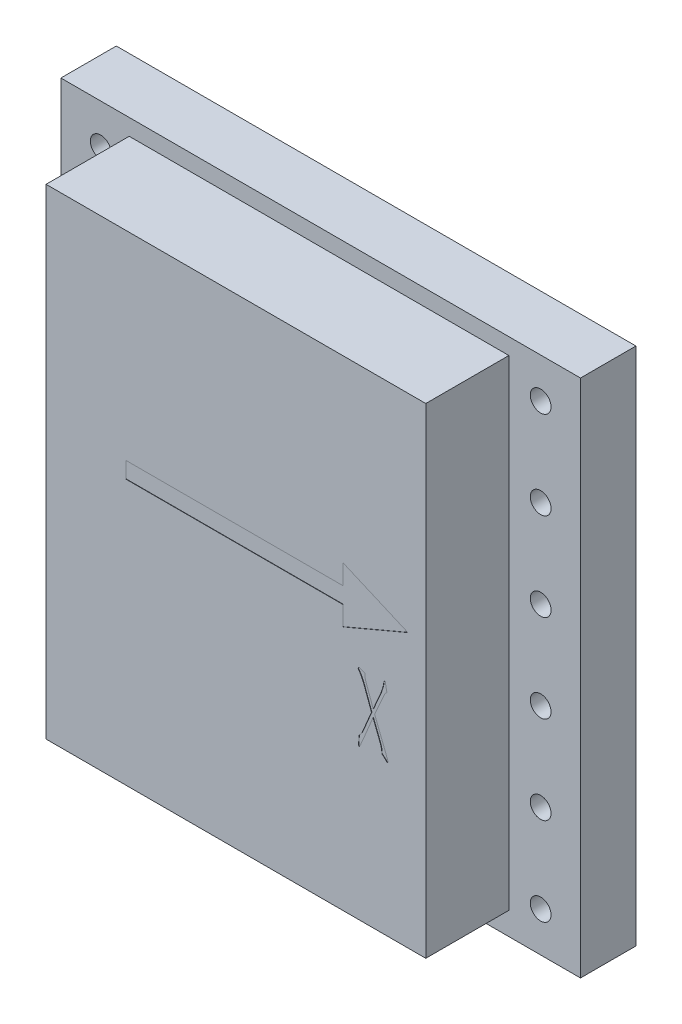
from build123d import *

# Parameters (mm, degrees)
SKETCH_1_W                 = 15
SKETCH_1_H                 = 15
EXTRUDE_1_DEPTH            = 1.6
SKETCH_2_W                 = 10.960360983
SKETCH_2_H                 = 13.870606726
EXTRUDE_2_DEPTH            = 2.4
SKETCH_3_R                 = 0.3
CUT_EXTRUDE_1_DEPTH        = 2.4
PATTERN_LINEAR_1_COUNT     = 4
PATTERN_LINEAR_1_PITCH     = 2.54
PATTERN_LINEAR_1_COL_COUNT = 3
PATTERN_LINEAR_1_COL_PITCH = 2.54
CUT_EXTRUDE_2_DEPTH        = 0.01
CUT_EXTRUDE_3_DEPTH        = 0.01


with BuildPart() as part:
    # 草图1 → 凸台-拉伸1 (new body)
    with BuildSketch(Plane.XY):
        with Locations((7.5, 7.5)):
            Rectangle(SKETCH_1_W, SKETCH_1_H)
    extrude(amount=EXTRUDE_1_DEPTH)

    # 草图2 → 凸台-拉伸2 (add)
    with BuildSketch(Plane.XY.offset(1.6)):
        with Locations((7.453060553, 7.593878895)):
            Rectangle(SKETCH_2_W, SKETCH_2_H)
    extrude(amount=EXTRUDE_2_DEPTH)

    # 草图3 → 切除-拉伸1 (cut)
    with BuildSketch(Plane.XY.offset(1.6)):
        with Locations((1.15, 8.77)):
            Circle(SKETCH_3_R)
        with Locations((13.85, 8.77)):
            Circle(SKETCH_3_R)
    cut_extrude_1 = extrude(amount=-CUT_EXTRUDE_1_DEPTH, mode=Mode.SUBTRACT)

    # 阵列(线性)1: 切除-拉伸1 ×4
    with Locations(*[(0, -i * PATTERN_LINEAR_1_PITCH, 0) for i in range(1, PATTERN_LINEAR_1_COUNT)]):
        add(cut_extrude_1, mode=Mode.SUBTRACT)

    # 阵列(线性)1 col: 切除-拉伸1 ×3
    with Locations(*[(0, i * PATTERN_LINEAR_1_COL_PITCH, 0) for i in range(1, PATTERN_LINEAR_1_COL_COUNT)]):
        add(cut_extrude_1, mode=Mode.SUBTRACT)

    # 草图4 → 切除-拉伸2 (cut)
    with BuildSketch(Plane.XY.offset(4)):
        Polygon((10.539329223, 8.779099943), (10.539329223, 9.356105561), (12.417225748, 8.544402706), (10.539329223, 7.747506957), (10.539329223, 8.309705469), (4.272912987, 8.309705469), (4.272912987, 8.779099943), align=None)
    extrude(amount=-CUT_EXTRUDE_2_DEPTH, mode=Mode.SUBTRACT)

    # 草图5 → 切除-拉伸3 (cut)
    with BuildSketch(Plane.XY.offset(4)):
        with BuildLine():
            Line((11.417194479, 6.135405226), (11.641792388, 6.652462011))
            add(Edge.make_bspline(
                [(11.641792388, 6.652462011), (11.644459763, 6.65915976), (11.650338175, 6.673920386), (11.659052259, 6.698612128), (11.668619361, 6.727827369), (11.678458783, 6.760197023), (11.688890182, 6.792254636), (11.696772433, 6.821510802), (11.70401352, 6.845628042), (11.711125127, 6.871472603), (11.717769102, 6.901008766), (11.720240181, 6.924455008), (11.721474297, 6.936164633)],
                knots=[0, 0, 0, 0, 0.732180493, 1.613593324, 2.658872914, 3.854365511, 5.049858108, 6.082130019, 6.931166509, 7.607179292, 8.804966943, 10, 10, 10, 10], degree=3))
            Line((11.721474297, 6.936164633), (11.727603675, 6.986513092))
            Line((11.727603675, 6.986513092), (11.763066503, 6.992204657))
            Line((11.763066503, 6.992204657), (11.810350273, 6.743964863))
            add(Edge.make_bspline(
                [(11.810350273, 6.743964863), (11.803983049, 6.737631034), (11.792553049, 6.726260986), (11.777524458, 6.70884618), (11.763839933, 6.690929745), (11.750533347, 6.674158962), (11.738681861, 6.654023987), (11.727167788, 6.630404394), (11.713111944, 6.598523577), (11.70330589, 6.574415593), (11.697832412, 6.560959159)],
                knots=[0, 0, 0, 0, 0.993153163, 1.782839525, 2.541730564, 3.487713786, 4.146615727, 5.1212284, 6.393146485, 8, 8, 8, 8], degree=3))
            Line((11.697832412, 6.560959159), (11.458348872, 6.020260488))
            Line((11.458348872, 6.020260488), (11.756937125, 5.263720162))
            Line((11.756937125, 5.263720162), (11.816041838, 5.110047909))
            add(Edge.make_bspline(
                [(11.816041838, 5.110047909), (11.822079493, 5.096645389), (11.83288347, 5.072662481), (11.839984094, 5.042737639), (11.842976482, 5.023548034), (11.84296091, 5.013580004), (11.842191359, 5.006194655), (11.83795984, 5.000752614), (11.831545964, 4.998931147), (11.823968923, 4.993934019), (11.812279554, 5.002811857), (11.800976383, 5.014822536), (11.789795068, 5.028797256), (11.782777893, 5.036658786), (11.78057901, 5.039122253)],
                knots=[0, 0, 0, 0, 2.761412339, 4.941361911, 5.773257577, 6.405449525, 6.825913753, 7.139309286, 7.63100465, 8.075064367, 8.689683572, 10.011329248, 11.37683553, 12, 12, 12, 12], degree=3))
            Line((11.78057901, 5.039122253), (11.706588666, 5.103918531))
            add(Edge.make_bspline(
                [(11.706588666, 5.103918531), (11.700534721, 5.10864155), (11.689838198, 5.116986501), (11.676902014, 5.128864442), (11.668284845, 5.13690868), (11.662006372, 5.144967182), (11.663920439, 5.158199661), (11.663417087, 5.177036268), (11.664666192, 5.203655954), (11.661208157, 5.223194895), (11.659304896, 5.2339489)],
                knots=[0, 0, 0, 0, 1.23478745, 2.181706523, 2.812113369, 3.150477244, 3.760922406, 4.816942161, 6.248082283, 8, 8, 8, 8], degree=3))
            add(Edge.make_bspline(
                [(11.659304896, 5.2339489), (11.657570283, 5.243875719), (11.654377363, 5.262148127), (11.650117136, 5.28526259), (11.645361423, 5.305687518), (11.637884912, 5.326783626), (11.62842129, 5.355050264), (11.616354369, 5.387606437), (11.604632167, 5.419985798), (11.594840708, 5.447418485), (11.588025611, 5.467332719), (11.584154921, 5.478105212), (11.582687675, 5.482188694)],
                knots=[0, 0, 0, 0, 1.161118987, 2.137284709, 2.708267813, 3.575038829, 4.713036419, 6.143931784, 7.57482715, 8.681074464, 9.500040603, 10, 10, 10, 10], degree=3))
            Line((11.582687675, 5.482188694), (11.411065101, 5.916498881))
            Line((11.411065101, 5.916498881), (11.127362479, 5.2339489))
            Line((11.127362479, 5.2339489), (11.056436823, 5.071520392))
            add(Edge.make_bspline(
                [(11.056436823, 5.071520392), (11.05092025, 5.059923819), (11.040956646, 5.038978994), (11.027354455, 5.015348737), (11.016079719, 5.003114277), (11.011484356, 4.997021281), (11.004967483, 4.995661847), (11.003967513, 4.998937252), (11.003461488, 5.000594736)],
                knots=[0, 0, 0, 0, 2.381178734, 4.300699059, 5.010137615, 5.450112729, 5.721735305, 6, 6, 6, 6], degree=3))
            add(Edge.make_bspline(
                [(11.003461488, 5.000594736), (11.00235785, 5.001407174), (10.999053439, 5.003839699), (10.996910869, 5.011909178), (10.99504437, 5.022224411), (10.99599754, 5.033010837), (10.996542411, 5.043928598), (10.996917787, 5.0559064), (10.997475336, 5.07136957), (10.997383003, 5.082756589), (10.99733211, 5.0890329)],
                knots=[0, 0, 0, 0, 0.356334141, 1.066903249, 2.083622437, 3.166508591, 3.901872409, 4.984758563, 6.338055839, 8, 8, 8, 8], degree=3))
            Line((10.99733211, 5.0890329), (11.003461488, 5.207242326))
            add(Edge.make_bspline(
                [(11.003461488, 5.207242326), (11.003934057, 5.21659073), (11.004762277, 5.232974646), (11.007181535, 5.254267464), (11.008840176, 5.269124933), (11.012439148, 5.28195374), (11.023092765, 5.294221944), (11.037370069, 5.309576468), (11.05273668, 5.325448758), (11.065473263, 5.341432509), (11.075914366, 5.358198204), (11.086335771, 5.37372244), (11.096619807, 5.390411315), (11.105496545, 5.409732657), (11.116850923, 5.43433534), (11.129168728, 5.463048743), (11.141556256, 5.491950012), (11.152595687, 5.517741604), (11.16110265, 5.538779801), (11.166589578, 5.550938225), (11.168954684, 5.556179038)],
                knots=[0, 0, 0, 0, 1.283891209, 2.250134334, 2.938194825, 3.337125035, 4.054003749, 5.116665614, 6.235914532, 7.077065651, 7.915591523, 8.942962049, 9.643436631, 10.601555545, 11.855913542, 13.362341093, 14.887150874, 16.17010505, 17.211235183, 18, 18, 18, 18], degree=3))
            Line((11.168954684, 5.556179038), (11.36684602, 6.025952053))
            Line((11.36684602, 6.025952053), (11.14224811, 6.637576379))
            add(Edge.make_bspline(
                [(11.14224811, 6.637576379), (11.134802276, 6.653919815), (11.118638723, 6.689398443), (11.098117731, 6.734589073), (11.080824683, 6.771330602), (11.069237657, 6.795692229), (11.058270064, 6.815063097), (11.044964524, 6.835312795), (11.028432624, 6.859216492), (11.015814861, 6.87863072), (11.009153053, 6.888880863)],
                knots=[0, 0, 0, 0, 1.512108789, 3.282513405, 4.178459187, 4.931286787, 5.553090324, 6.050678811, 6.970815613, 8, 8, 8, 8], degree=3))
            Line((11.009153053, 6.888880863), (10.982884292, 6.924343691))
            Line((10.982884292, 6.924343691), (10.99733211, 6.968562772))
            Line((10.99733211, 6.968562772), (11.172019373, 6.906831183))
            add(Edge.make_bspline(
                [(11.172019373, 6.906831183), (11.172798131, 6.895160011), (11.174219289, 6.87386124), (11.175579615, 6.842681643), (11.179648195, 6.810360509), (11.185071037, 6.779955978), (11.192270701, 6.750508012), (11.200401611, 6.723903561), (11.209803376, 6.693508399), (11.217725107, 6.672414865), (11.22193002, 6.661218265)],
                knots=[0, 0, 0, 0, 1.113815777, 2.032607081, 2.970224408, 4.213083212, 4.971379877, 5.85514338, 6.861494526, 8, 8, 8, 8], degree=3))
            Line((11.22193002, 6.661218265), (11.417194479, 6.135405226))
        make_face()
    extrude(amount=-CUT_EXTRUDE_3_DEPTH, mode=Mode.SUBTRACT)


solid = part.part
